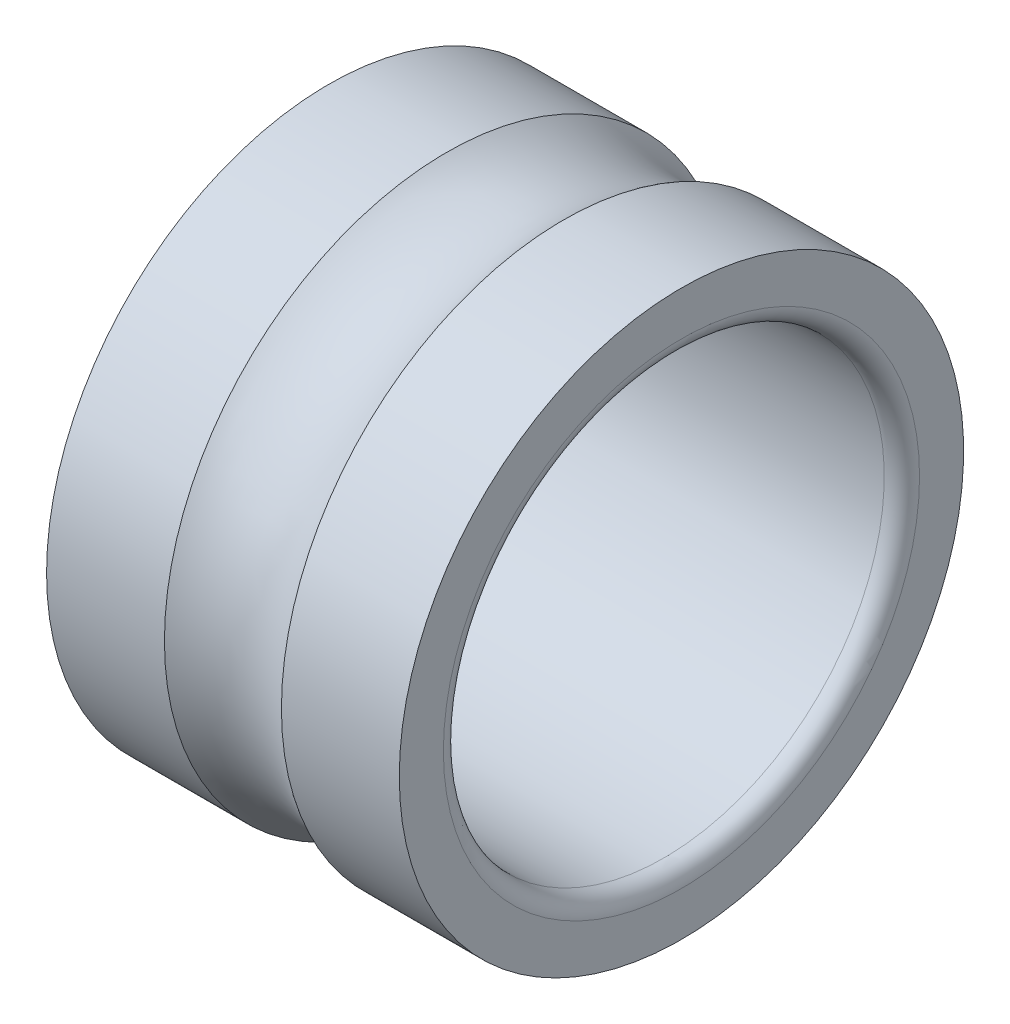
from build123d import *


with BuildPart() as part:
    # Sketch1 → Revolve1 (revolve)
    with BuildSketch(Plane.XY, mode=Mode.PRIVATE) as revolve1_sk:
        with BuildLine():
            Line((10, 16), (3.31662479, 16))
            ThreePointArc((3.31662479, 16), (0, 15), (-3.31662479, 16))
            Line((-3.31662479, 16), (-10, 16))
            Line((-10, 16), (-10, 13.5))
            ThreePointArc((-10, 13.5), (-9.707106781, 12.792893219), (-9, 12.5))
            Line((-9, 12.5), (9, 12.5))
            ThreePointArc((9, 12.5), (9.707106781, 12.792893219), (10, 13.5))
            Line((10, 13.5), (10, 16))
        make_face()
    revolve(revolve1_sk.sketch.rotate(Axis((-27.777777778, 0, 0), (1, 0, 0)), 90), axis=Axis((-27.777777778, 0, 0), (1, 0, 0)))


solid = part.part
